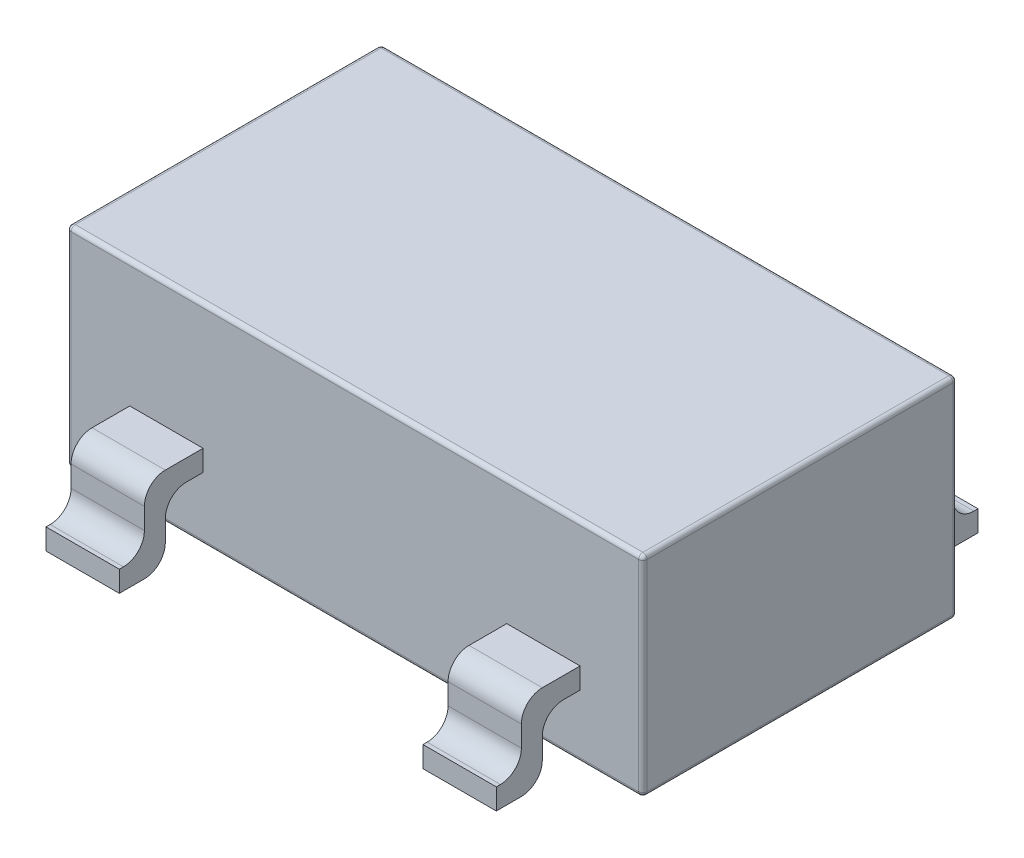
from build123d import *

# Parameters (mm, degrees)
SKETCH1_W           = 2.75
SKETCH1_H           = 1.5
BOSS_EXTRUDE1_DEPTH = 1
SKETCH2_W           = 0.35
SKETCH2_H           = 0.4
BOSS_EXTRUDE2_DEPTH = 0.4
CUT_EXTRUDE1_DEPTH  = 3.885307609
FILLET1_R           = 0.02


with BuildPart() as part:
    # Sketch1 → Boss-Extrude1 (new body)
    with BuildSketch(Plane(origin=(0, 0, 0), x_dir=(1, 0, 0), z_dir=(0, 1, 0))):
        Rectangle(SKETCH1_W, SKETCH1_H)
    extrude(amount=BOSS_EXTRUDE1_DEPTH)

    # Sketch2 → Boss-Extrude2 (add)
    with BuildSketch(Plane(origin=(0, 0, 0), x_dir=(1, 0, 0), z_dir=(0, 1, 0))):
        with Locations((-0.9, -0.95)):
            Rectangle(SKETCH2_W, SKETCH2_H)
        with Locations((0.9, -0.95)):
            Rectangle(SKETCH2_W, SKETCH2_H)
        with Locations((0.9, 0.95)):
            Rectangle(SKETCH2_W, SKETCH2_H)
        with Locations((-0.9, 0.95)):
            Rectangle(SKETCH2_W, SKETCH2_H)
        with Locations((0.01189142, 0.95)):
            Rectangle(SKETCH2_W, SKETCH2_H)
    extrude(amount=BOSS_EXTRUDE2_DEPTH)

    # Sketch3 → Cut-Extrude1 (cut, through all)
    with BuildSketch(Plane(origin=(1.075, 0, 0), x_dir=(0, 0, -1), z_dir=(1, 0, 0))):
        with BuildLine():
            Line((1.15, 0), (1.03024595, 0))
            Line((1.03024595, 0), (0.75, 0))
            Line((0.75, 0), (-0.75, 0))
            Line((-0.75, 0), (-0.75, 0.3))
            Line((-0.75, 0.3), (-0.83024595, 0.3))
            ThreePointArc((-0.83024595, 0.3), (-0.900956628, 0.270710678), (-0.93024595, 0.2))
            Line((-0.93024595, 0.2), (-0.93024595, 0.1))
            ThreePointArc((-0.93024595, 0.1), (-0.959535272, 0.029289322), (-1.03024595, 0))
            Line((-1.03024595, 0), (-1.15, 0))
            Line((-1.15, 0), (-1.15, 0.1))
            Line((-1.15, 0.1), (-1.13024595, 0.1))
            ThreePointArc((-1.13024595, 0.1), (-1.059535272, 0.129289322), (-1.03024595, 0.2))
            Line((-1.03024595, 0.2), (-1.03024595, 0.3))
            ThreePointArc((-1.03024595, 0.3), (-1.000956628, 0.370710678), (-0.93024595, 0.4))
            Line((-0.93024595, 0.4), (-0.75, 0.4))
            Line((-0.75, 0.4), (-0.75, 0.722069531))
            Line((-0.75, 0.722069531), (-1.439294861, 0.722069531))
            Line((-1.439294861, 0.722069531), (-1.439294861, -0.262815914))
            Line((-1.439294861, -0.262815914), (1.563550176, -0.262815914))
            Line((1.563550176, -0.262815914), (1.563550176, 0.722069531))
            Line((1.563550176, 0.722069531), (0.75, 0.722069531))
            Line((0.75, 0.722069531), (0.75, 0.4))
            Line((0.75, 0.4), (0.93024595, 0.4))
            Line((0.93024595, 0.4), (1.15, 0.4))
            Line((1.15, 0.4), (1.15, 0.1))
            Line((1.15, 0.1), (1.15, 0))
        make_face()
        with BuildLine():
            Line((0.75, 0), (1.03024595, 0))
            ThreePointArc((1.03024595, 0), (0.959535272, 0.029289322), (0.93024595, 0.1))
            Line((0.93024595, 0.1), (0.93024595, 0.2))
            ThreePointArc((0.93024595, 0.2), (0.900956628, 0.270710678), (0.83024595, 0.3))
            Line((0.83024595, 0.3), (0.75, 0.3))
            Line((0.75, 0.3), (0.75, 0))
        make_face()
        with BuildLine():
            Line((1.13024595, 0.1), (1.15, 0.1))
            Line((1.15, 0.1), (1.15, 0.4))
            Line((1.15, 0.4), (0.93024595, 0.4))
            ThreePointArc((0.93024595, 0.4), (1.000956628, 0.370710678), (1.03024595, 0.3))
            Line((1.03024595, 0.3), (1.03024595, 0.2))
            ThreePointArc((1.03024595, 0.2), (1.059535272, 0.129289322), (1.13024595, 0.1))
        make_face()
    extrude(amount=-CUT_EXTRUDE1_DEPTH, mode=Mode.SUBTRACT)

    # Fillet1
    fillet1_edges = [part.edges().sort_by_distance(p)[0] for p in [
        (-1.375, 1, 0),
        (0, 1, 0.75),
        (1.375, 1, 0),
        (0, 0, 0.75),
        (-1.375, 0, 0),
        (0, 0, -0.75),
        (1.375, 0, 0),
        (0, 1, -0.75),
        (1.375, 0.5, 0.75),
        (-1.375, 0.5, 0.75),
        (-1.375, 0.5, -0.75),
        (1.375, 0.5, -0.75),
    ]]
    fillet(fillet1_edges, radius=FILLET1_R)


solid = part.part
